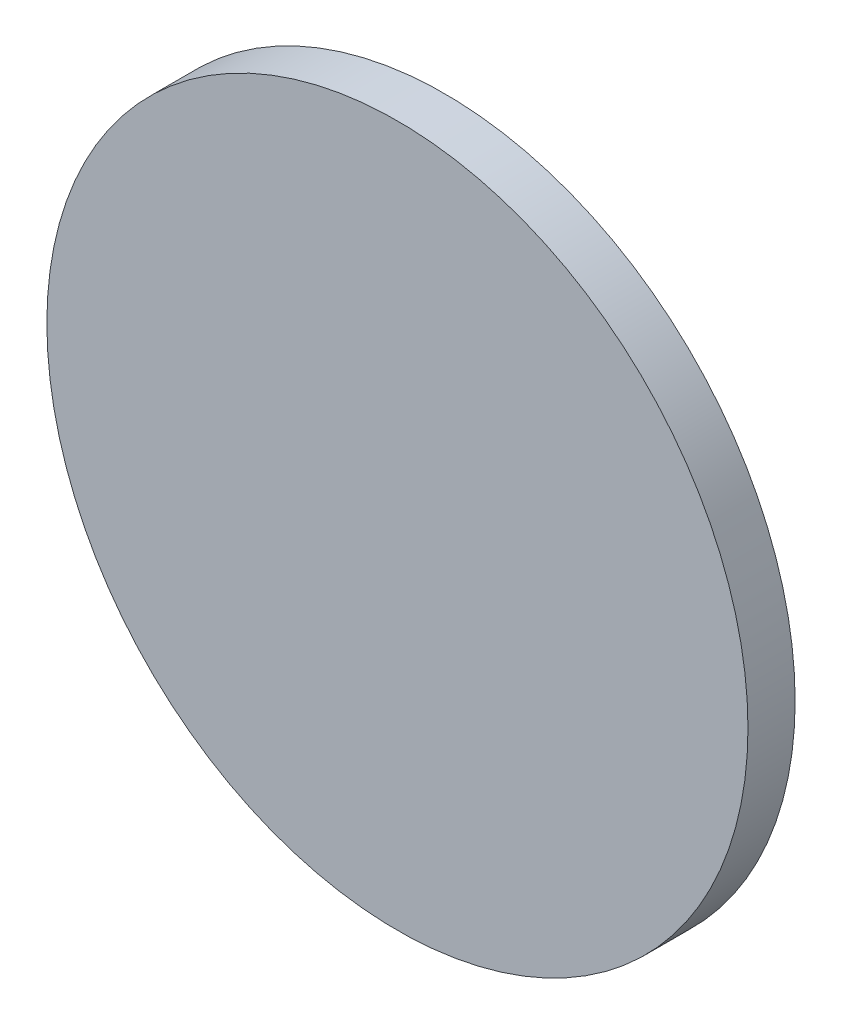
from build123d import *

# Parameters (mm, degrees)
SKETCH1_R           = 74.323239405
BOSS_EXTRUDE1_DEPTH = 10


with BuildPart() as part:
    # Sketch1 → Boss-Extrude1 (new body)
    with BuildSketch(Plane.XY):
        Circle(SKETCH1_R)
    extrude(amount=BOSS_EXTRUDE1_DEPTH)


solid = part.part
